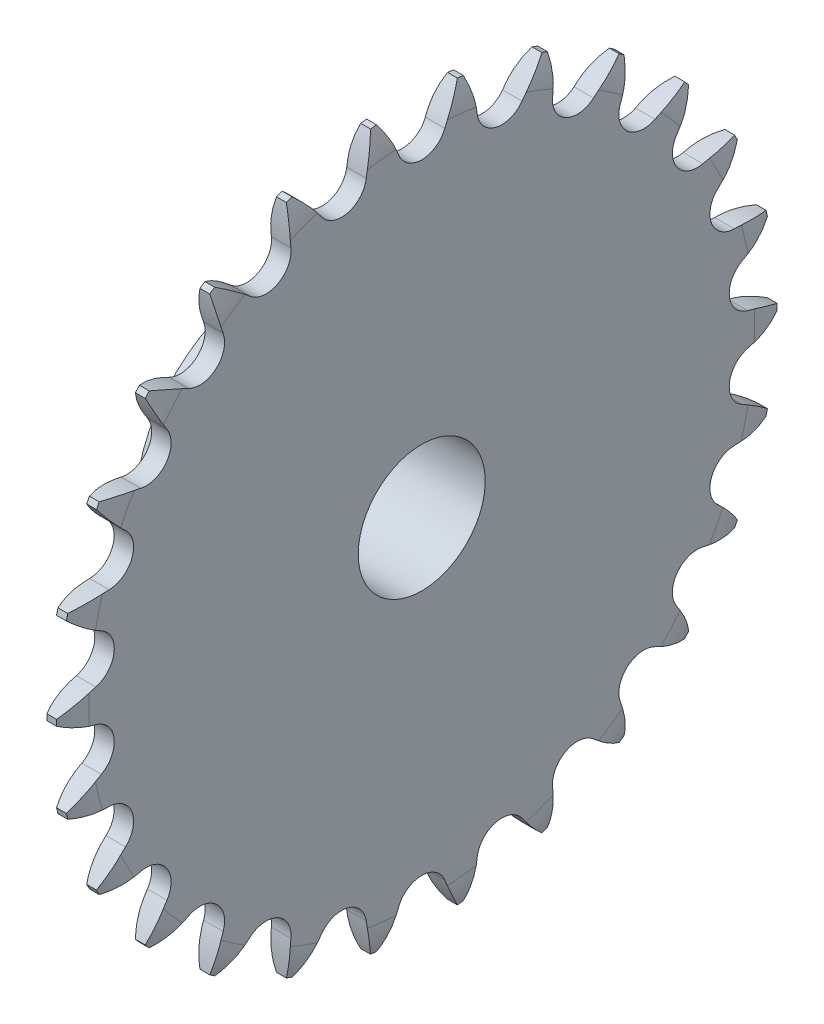
from build123d import *

# Parameters (mm, degrees)
TOOTHCUT_DEPTH           = 81.306175466
TEETHCUTS_COUNT          = 26
TEETHCUTS_ANGLE          = 346.153846154
HUBNEAONESKE_R           = 21
HUBNEARONE_DEPTH         = 24
HUBNEARONEFILLET_R       = 0.6
BORSKE_R                 = 10
BORE_DEPTH               = 25.0005
SKETCH_1_W               = 8
SKETCH_1_H               = 8
CHAMFER_1_SIZE           = 3
CHAMFER_1_SIZE2          = 10.462243332
CUT_EXTRUDE_2_DEPTH      = 84.517052199
CUT_EXTRUDE_2_DEPTH_BACK = 84.517052199


with BuildPart() as part:
    # BasProSke → Base-Revolve (revolve)
    with BuildSketch(Plane(origin=(0, 0, 0), x_dir=(1, 0, 0), z_dir=(0, 1, 0)), mode=Mode.PRIVATE) as base_revolve_sk:
        with BuildLine():
            Line((0, 0), (0, 52.410643941))
            ThreePointArc((0, 52.410643941), (0.191950592, 54.610348467), (0.762, 56.743559357))
            Line((0.762, 56.743559357), (2.307, 56.743559357))
            ThreePointArc((2.307, 56.743559357), (2.877049408, 54.610348467), (3.069, 52.410643941))
            Line((3.069, 52.410643941), (3.069, 0))
            Line((3.069, 0), (0, 0))
        make_face()
    revolve(base_revolve_sk.sketch.rotate(Axis((-10, 0, 0), (1, 0, 0)), 180), axis=Axis((-10, 0, 0), (1, 0, 0)))

    # TooCutSke → ToothCut (cut, through all)
    with BuildSketch(Plane(origin=(0, 0, 0), x_dir=(0, 0, -1), z_dir=(1, 0, 0))):
        with BuildLine():
            ThreePointArc((3.635614951, 51.270760363), (4.995081237, 54.154497716), (6.696756898, 56.850492829))
            ThreePointArc((6.696756898, 56.850492829), (0, 57.243559357), (-6.696756898, 56.850492829))
            ThreePointArc((-6.696756898, 56.850492829), (-4.995081237, 54.154497716), (-3.635614951, 51.270760363))
            ThreePointArc((-3.635614951, 51.270760363), (0, 48.806059357), (3.635614951, 51.270760363))
        make_face()
    toothcut = extrude(amount=TOOTHCUT_DEPTH, mode=Mode.SUBTRACT)

    # TeethCuts: ToothCut ×26 about axis
    teethcuts_axis = Axis((-10, 0, 0), (1, 0, 0))
    for i in range(1, TEETHCUTS_COUNT):
        add(toothcut.rotate(teethcuts_axis, i * TEETHCUTS_ANGLE / (TEETHCUTS_COUNT - 1)), mode=Mode.SUBTRACT)

    # HubNeaOneSke → HubNearOne (add)
    with BuildSketch(Plane.ZY):
        with Locations(Location((0, 0, 0), (0, 0, 180))):
            Circle(HUBNEAONESKE_R)
    extrude(amount=HUBNEARONE_DEPTH)

    # HubNearOneFillet
    hubnearonefillet_edges = [part.edges().sort_by_distance(p)[0] for p in [
        (0, 0, 21),
    ]]
    fillet(hubnearonefillet_edges, radius=HUBNEARONEFILLET_R)

    # BorSke → Bore (cut, symmetric)
    with BuildSketch(Plane(origin=(0, 0, 0), x_dir=(0, 0, -1), z_dir=(1, 0, 0))):
        with Locations(Location((0, 0, 0), (0, 0, 180))):
            Circle(BORSKE_R)
    extrude(amount=BORE_DEPTH, both=True, mode=Mode.SUBTRACT)

    # Вырез-По траектории1: sweep along a curve in space
    with BuildLine() as sweep_1_path:
        ThreePointArc((-24, 0, 21), (-24, 14.849242405, 14.849242405), (-24, 21, 0))
        ThreePointArc((-24, 21, 0), (-24, 14.849242405, -14.849242405), (-24, 0, -21))
        ThreePointArc((-24, 0, -21), (-24, -14.849242405, -14.849242405), (-24, -21, 0))
        ThreePointArc((-24, -21, 0), (-24, -14.849242405, 14.849242405), (-24, 0, 21))
    # Эскиз1 → Вырез-По траектории1 (sweep, cut)
    with BuildSketch(Plane.XY):
        with Locations((-11, 17)):
            Rectangle(SKETCH_1_W, SKETCH_1_H)
    sweep(path=sweep_1_path.line, mode=Mode.SUBTRACT)

    # Фаска1
    chamfer_1_edges = [part.edges().sort_by_distance(p)[0] for p in [
        (-24, 0, 21),
    ]]
    chamfer_1_side = [part.faces().sort_by_distance(p)[0] for p in [
        (-19.5, 0, 21),
    ]]
    chamfer(chamfer_1_edges, length=CHAMFER_1_SIZE, length2=CHAMFER_1_SIZE2, reference=chamfer_1_side[0])

    # Эскиз2 → Вырез-Вытянуть2 (cut, two sides: drawn at the far end of the back side and taken through both)
    with BuildSketch(Plane(origin=(0, 0, 0), x_dir=(1, 0, 0), z_dir=(0, 1, 0)).offset(-CUT_EXTRUDE_2_DEPTH_BACK)):
        with BuildLine():
            Line((-21.9, -4.1), (-36.79677296, -4.1))
            Line((-36.79677296, -4.1), (-36.79677296, 3.920775429))
            Line((-36.79677296, 3.920775429), (-21.9, 4.1))
            ThreePointArc((-21.9, 4.1), (-17.8, 0), (-21.9, -4.1))
        make_face()
    extrude(amount=CUT_EXTRUDE_2_DEPTH + CUT_EXTRUDE_2_DEPTH_BACK, mode=Mode.SUBTRACT)


solid = part.part
